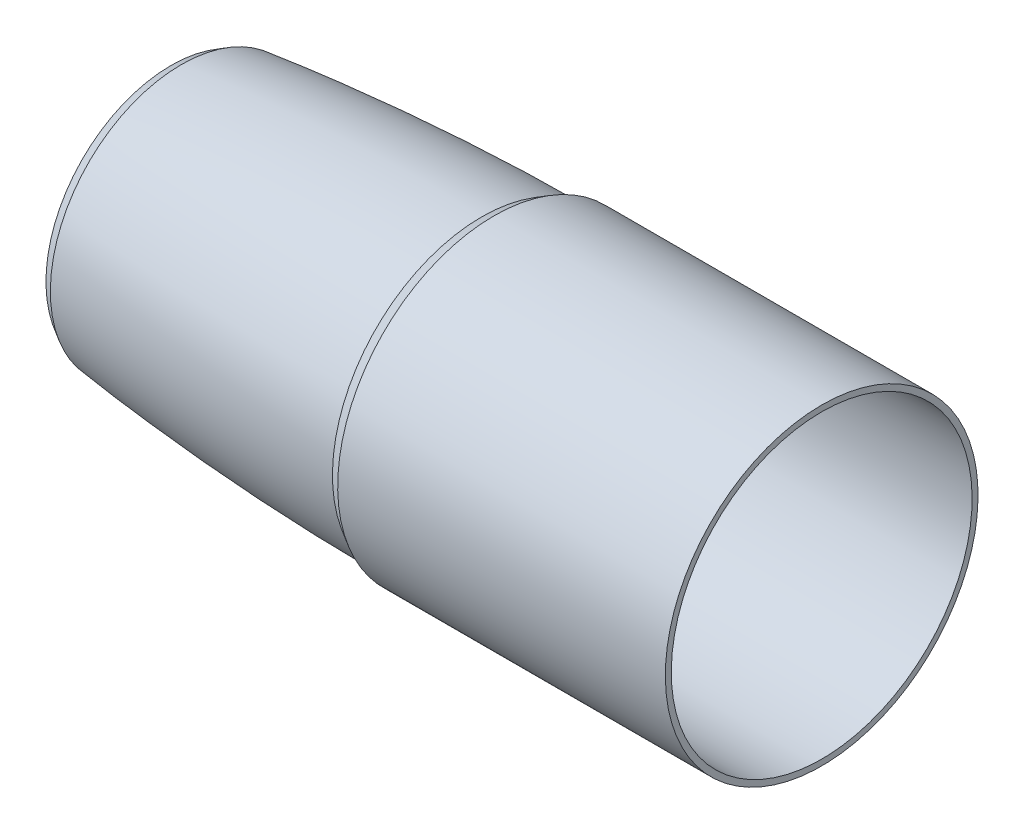
from build123d import *


with BuildPart() as part:
    # Sketch1 → Revolve1 (revolve)
    with BuildSketch(Plane.XY):
        with BuildLine():
            Line((83, 39.6), (0, 39.6))
            Line((0, 39.6), (-3.130167405, 37.792797006))
            ThreePointArc((-3.130167405, 37.792797006), (-41.229842374, 36.549169367), (-79.2, 33.172932948))
            Line((-79.2, 33.172932948), (-81.838582433, 31.649546669))
            ThreePointArc((-81.838582433, 31.649546669), (-40.994086656, 35.361256598), (0, 36.6))
            Line((0, 36.6), (2.598076211, 38.1))
            Line((2.598076211, 38.1), (83, 38.1))
            Line((83, 38.1), (83, 39.6))
        make_face()
    revolve(axis=Axis((0, 0, 0), (-1, 0, 0)))


solid = part.part
